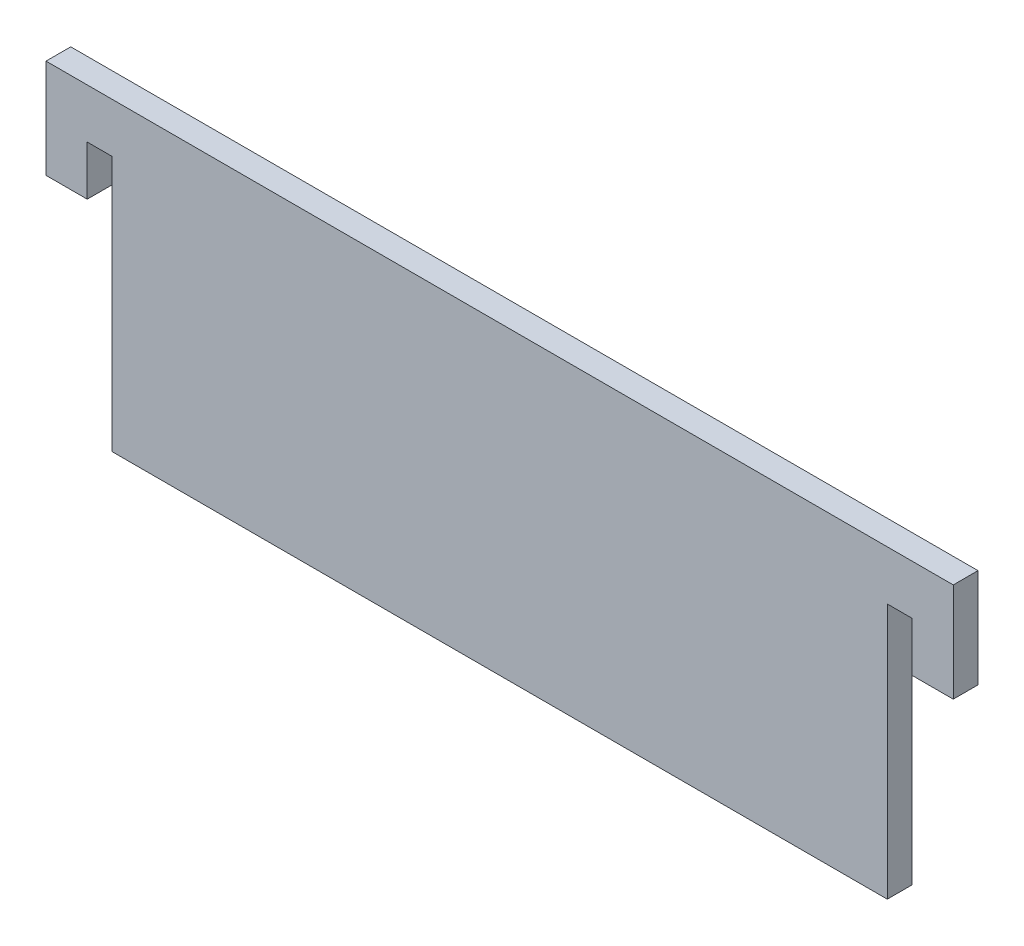
from build123d import *

# Parameters (mm, degrees)
EXTRUDE_1_DEPTH     = 3
SKETCH_2_W          = 100
SKETCH_2_H          = 37
EXTRUDE_2_DEPTH     = 3
SKETCH_3_W          = 5
SKETCH_3_H          = 12
EXTRUDE_3_DEPTH     = 3
SKETCH_4_W          = 3
SKETCH_4_H          = 31
CUT_EXTRUDE_1_DEPTH = 3


with BuildPart() as part:
    # 草圖1 → 填料-伸長1 (new body)
    with BuildSketch(Plane.XY):
        Polygon((49.262888429, -21.540240663), (49.262888429, -18.540240663), (39.262888429, -18.540240663), (39.262888429, -21.540240663), (25.262888429, -21.540240663), (25.262888429, -18.540240663), (15.262888429, -18.540240663), (15.262888429, -21.540240663), (1.262888429, -21.540240663), (1.262888429, -18.540240663), (-8.737111571, -18.540240663), (-8.737111571, -21.540240663), (-22.737111571, -21.540240663), (-22.737111571, -18.540240663), (-32.737111571, -18.540240663), (-32.737111571, -21.540240663), (-41.737111571, -21.540240663), (-41.737111571, -8.040240663), (-38.737111571, -8.040240663), (-38.737111571, 1.959759337), (-41.737111571, 1.959759337), (-41.737111571, 15.459759337), (-32.737111571, 15.459759337), (-32.737111571, 12.459759337), (-22.737111571, 12.459759337), (-22.737111571, 15.459759337), (-8.737111571, 15.459759337), (-8.737111571, 12.459759337), (1.262888429, 12.459759337), (1.262888429, 15.459759337), (15.262888429, 15.459759337), (15.262888429, 12.459759337), (25.262888429, 12.459759337), (25.262888429, 15.459759337), (39.262888429, 15.459759337), (39.262888429, 12.459759337), (49.262888429, 12.459759337), (49.262888429, 15.459759337), (58.262888429, 15.459759337), (58.262888429, 1.959759337), (55.262888429, 1.959759337), (55.262888429, -8.040240663), (58.262888429, -8.040240663), (58.262888429, -21.540240663), align=None)
    extrude(amount=EXTRUDE_1_DEPTH)

    # 草圖2 → 填料-伸長2 (add)
    with BuildSketch(Plane.XY.offset(3)):
        with Locations((8.262888429, -3.040240663)):
            Rectangle(SKETCH_2_W, SKETCH_2_H)
    extrude(amount=-EXTRUDE_2_DEPTH)

    # 草圖3 → 填料-伸長3 (add)
    with BuildSketch(Plane.XY.offset(3)):
        with Locations((60.762888429, 9.459759337)):
            Rectangle(SKETCH_3_W, SKETCH_3_H)
        with Locations((-44.237111571, 9.459759337)):
            Rectangle(SKETCH_3_W, SKETCH_3_H)
    extrude(amount=-EXTRUDE_3_DEPTH)

    # 草圖4 → 除料-伸長1 (cut)
    with BuildSketch(Plane.XY.offset(3)):
        with Locations((-40.237111571, -6.040240663)):
            Rectangle(SKETCH_4_W, SKETCH_4_H)
        with Locations((56.762888429, -6.040240663)):
            Rectangle(SKETCH_4_W, SKETCH_4_H)
    extrude(amount=-CUT_EXTRUDE_1_DEPTH, mode=Mode.SUBTRACT)


solid = part.part
